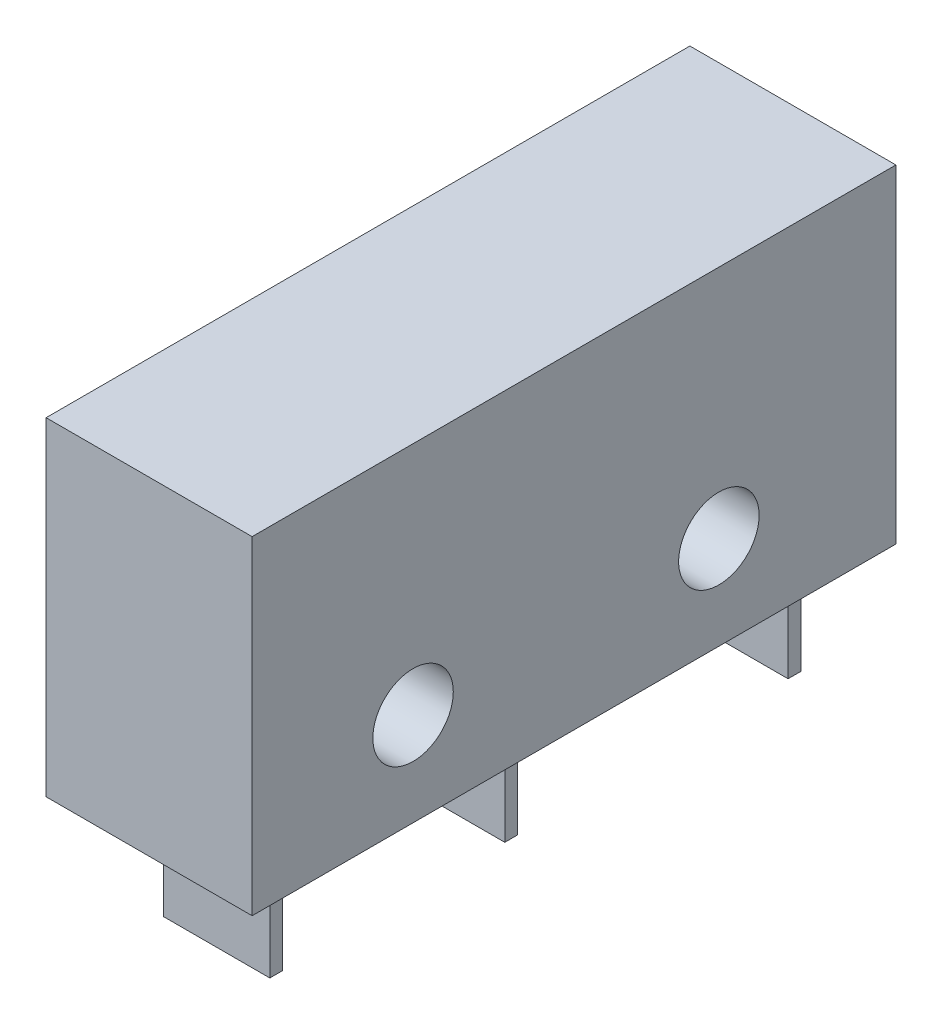
from build123d import *

# Parameters (mm, degrees)
SKETCH1_W               = 20
SKETCH1_H               = 10.2
BOSS_EXTRUDE1_DEPTH     = 3.2
CUT_EXTRUDE1_DEPTH      = 12.67261753
CUT_EXTRUDE1_DEPTH_BACK = 12.67261753
SKETCH2_R               = 1.25
SKETCH3_W               = 3.3
SKETCH3_H               = 0.4
BOSS_EXTRUDE2_DEPTH     = 3.5


with BuildPart() as part:
    # Sketch1 → Boss-Extrude1 (new, symmetric)
    with BuildSketch(Plane(origin=(0, 0, 0), x_dir=(0, 0, -1), z_dir=(1, 0, 0))):
        Rectangle(SKETCH1_W, SKETCH1_H)
    extrude(amount=BOSS_EXTRUDE1_DEPTH, both=True)

    # Sketch2 → Cut-Extrude1 (cut, two sides: drawn at the far end of the back side and taken through both)
    with BuildSketch(Plane(origin=(0, 0, 0), x_dir=(0, 0, -1), z_dir=(1, 0, 0)).offset(-CUT_EXTRUDE1_DEPTH_BACK)):
        with Locations((-5, -2.2)):
            Circle(SKETCH2_R)
        with Locations((4.5, -2.2)):
            Circle(SKETCH2_R)
    extrude(amount=CUT_EXTRUDE1_DEPTH + CUT_EXTRUDE1_DEPTH_BACK, mode=Mode.SUBTRACT)

    # Sketch3 → Boss-Extrude2 (add)
    with BuildSketch(Plane.XZ.offset(5.1)):
        with Locations((0, -8.4)):
            Rectangle(SKETCH3_W, SKETCH3_H)
        with Locations((0, 0.4)):
            Rectangle(SKETCH3_W, SKETCH3_H)
        with Locations((0, 7.7)):
            Rectangle(SKETCH3_W, SKETCH3_H)
    extrude(amount=BOSS_EXTRUDE2_DEPTH)


solid = part.part
